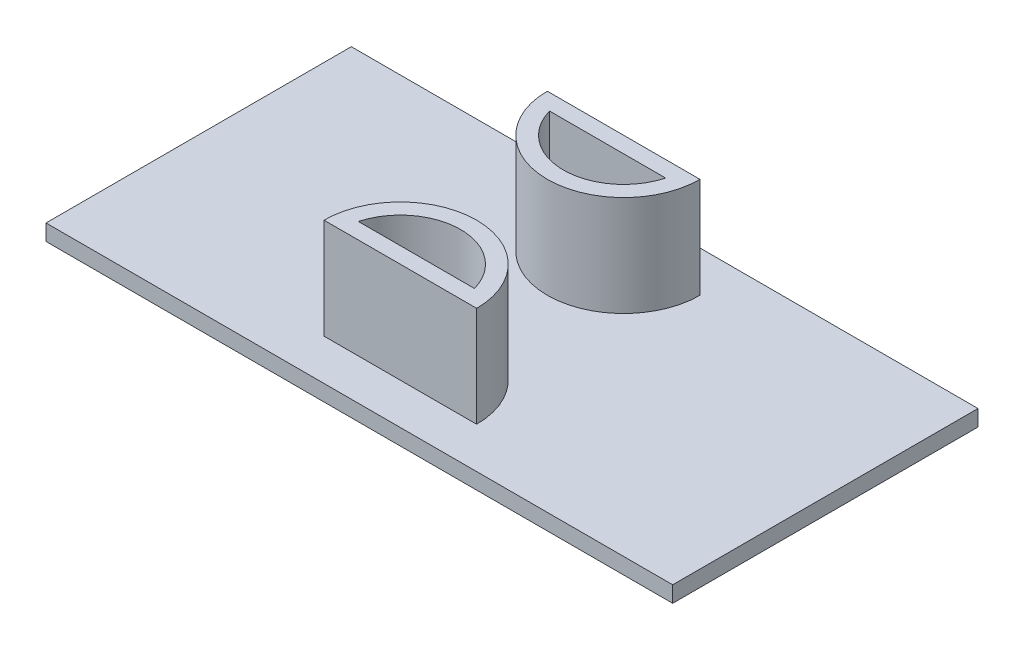
from build123d import *

# Parameters (mm, degrees)
SKETCH1_W           = 39
SKETCH1_H           = 19
BOSS_EXTRUDE1_DEPTH = 1
BOSS_EXTRUDE2_DEPTH = 6.25


with BuildPart() as part:
    # Sketch1 → Boss-Extrude1 (new body)
    with BuildSketch(Plane(origin=(0, 0, 0), x_dir=(1, 0, 0), z_dir=(0, 1, 0))):
        with Locations((7.081578947, 0.711842105)):
            Rectangle(SKETCH1_W, SKETCH1_H)
    extrude(amount=BOSS_EXTRUDE1_DEPTH)

    # Sketch2 → Boss-Extrude2 (add)
    # profile 1 of 2: a face of its own
    with BuildSketch(Plane(origin=(0, 1, 0), x_dir=(1, 0, 0), z_dir=(0, 1, 0))):
        with BuildLine():
            Line((2.331578947, 7.661842105), (11.831578947, 7.661842105))
            ThreePointArc((11.831578947, 7.661842105), (7.081578947, 2.911842105), (2.331578947, 7.661842105))
        make_face()
        with BuildLine():
            Line((3.467370874, 6.661842105), (10.695787021, 6.661842105))
            ThreePointArc((10.695787021, 6.661842105), (7.081578947, 3.911842105), (3.467370874, 6.661842105))
        make_face(mode=Mode.SUBTRACT)
    # profile 2 of 2: a face of its own
    with BuildSketch(Plane(origin=(0, 1, 0), x_dir=(1, 0, 0), z_dir=(0, 1, 0))):
        with BuildLine():
            Line((2.331578947, -6.238157895), (11.831578947, -6.238157895))
            ThreePointArc((11.831578947, -6.238157895), (7.081578947, -1.488157895), (2.331578947, -6.238157895))
        make_face()
        with BuildLine():
            Line((3.467370874, -5.238157895), (10.695787021, -5.238157895))
            ThreePointArc((10.695787021, -5.238157895), (7.081578947, -2.488157895), (3.467370874, -5.238157895))
        make_face(mode=Mode.SUBTRACT)
    extrude(amount=BOSS_EXTRUDE2_DEPTH)


solid = part.part
